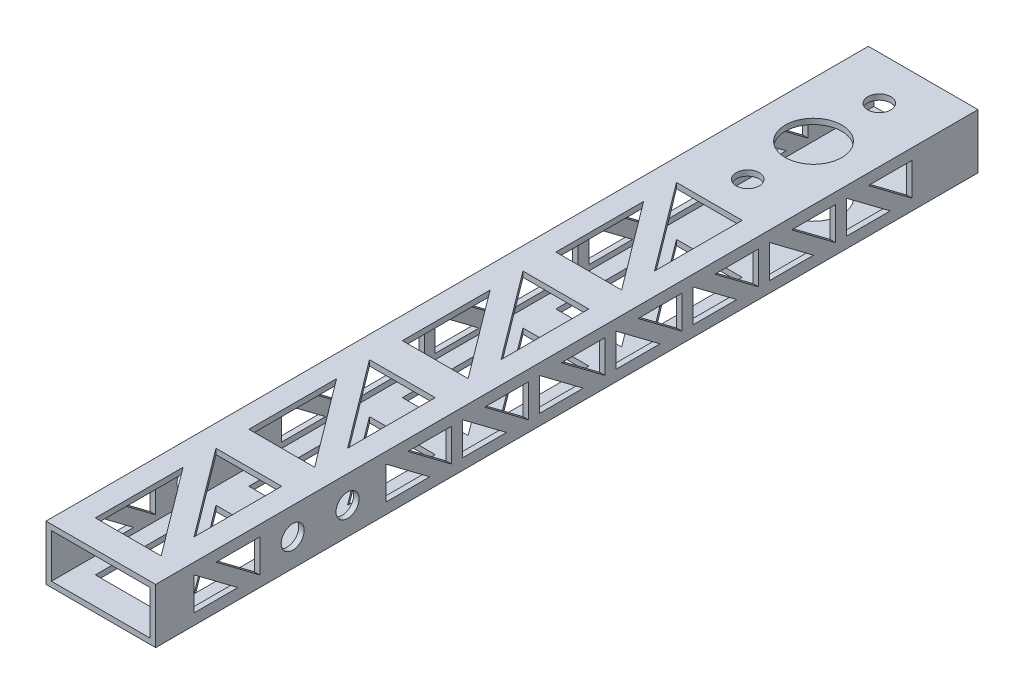
from build123d import *

# Parameters (mm, degrees)
SKETCH_1_W          = 20
SKETCH_1_H          = 10
SKETCH_1_W_2        = 18
SKETCH_1_H_2        = 8
EXTRUDE_1_DEPTH     = 150
SKETCH_2_R          = 2.1
CUT_EXTRUDE_1_DEPTH = 152.657508881
SKETCH_3_R          = 5.15
SKETCH_3_R_2        = 2.1
CUT_EXTRUDE_2_DEPTH = 152.657508881


with BuildPart() as part:
    # 草图1 → 拉伸-薄壁1 (new body)
    with BuildSketch(Plane.XY):
        with Locations((10, -5)):
            Rectangle(SKETCH_1_W, SKETCH_1_H)
        with Locations((10, -5)):
            Rectangle(SKETCH_1_W_2, SKETCH_1_H_2, mode=Mode.SUBTRACT)
    extrude(amount=EXTRUDE_1_DEPTH)

    # 草图2 → 切除-拉伸1 (cut, through all)
    with BuildSketch(Plane(origin=(20, 0, 0), x_dir=(0, 0, -1), z_dir=(1, 0, 0))):
        with Locations(Location((-115, -5, 0), (0, 0, 180))):
            Circle(SKETCH_2_R)
        with Locations(Location((-125, -5, 0), (0, 0, 180))):
            Circle(SKETCH_2_R)
        Polygon((-108, -2), (-108, -8), (-100, -8), align=None)
        Polygon((-104, -2), (-96, -2), (-96, -8), align=None)
        Polygon((-90, -2), (-82, -2), (-82, -8), align=None)
        Polygon((-86, -8), (-94, -2), (-94, -8), align=None)
        Polygon((-76, -2), (-68, -2), (-68, -8), align=None)
        Polygon((-72, -8), (-80, -2), (-80, -8), align=None)
        Polygon((-62, -2), (-54, -2), (-54, -8), align=None)
        Polygon((-58, -8), (-66, -2), (-66, -8), align=None)
        Polygon((-48, -2), (-40, -2), (-40, -8), align=None)
        Polygon((-44, -8), (-52, -2), (-52, -8), align=None)
        Polygon((-34, -2), (-26, -2), (-26, -8), align=None)
        Polygon((-30, -8), (-38, -2), (-38, -8), align=None)
        Polygon((-20, -2), (-12, -2), (-12, -8), align=None)
        Polygon((-16, -8), (-24, -2), (-24, -8), align=None)
        Polygon((-139, -2), (-131, -2), (-131, -8), align=None)
        Polygon((-135, -8), (-143, -2), (-143, -8), align=None)
    extrude(amount=-CUT_EXTRUDE_1_DEPTH, mode=Mode.SUBTRACT)

    # 草图3 → 切除-拉伸2 (cut, through all)
    with BuildSketch(Plane(origin=(0, 0, 0), x_dir=(1, 0, 0), z_dir=(0, 1, 0))):
        with Locations(Location((10, -20, 0), (0, 0, 270))):
            Circle(SKETCH_3_R)
        with Locations(Location((10, -8, 0), (0, 0, 270))):
            Circle(SKETCH_3_R_2)
        with Locations(Location((10, -32, 0), (0, 0, 90))):
            Circle(SKETCH_3_R_2)
        Polygon((4, -129), (4, -145), (16, -145), align=None)
        Polygon((4, -123), (16, -123), (16, -139), align=None)
        Polygon((4, -95), (16, -95), (16, -111), align=None)
        Polygon((16, -117), (4, -101), (4, -117), align=None)
        Polygon((4, -67), (16, -67), (16, -83), align=None)
        Polygon((16, -89), (4, -73), (4, -89), align=None)
        Polygon((4, -39), (16, -39), (16, -55), align=None)
        Polygon((16, -61), (4, -45), (4, -61), align=None)
    extrude(amount=-CUT_EXTRUDE_2_DEPTH, mode=Mode.SUBTRACT)


solid = part.part
